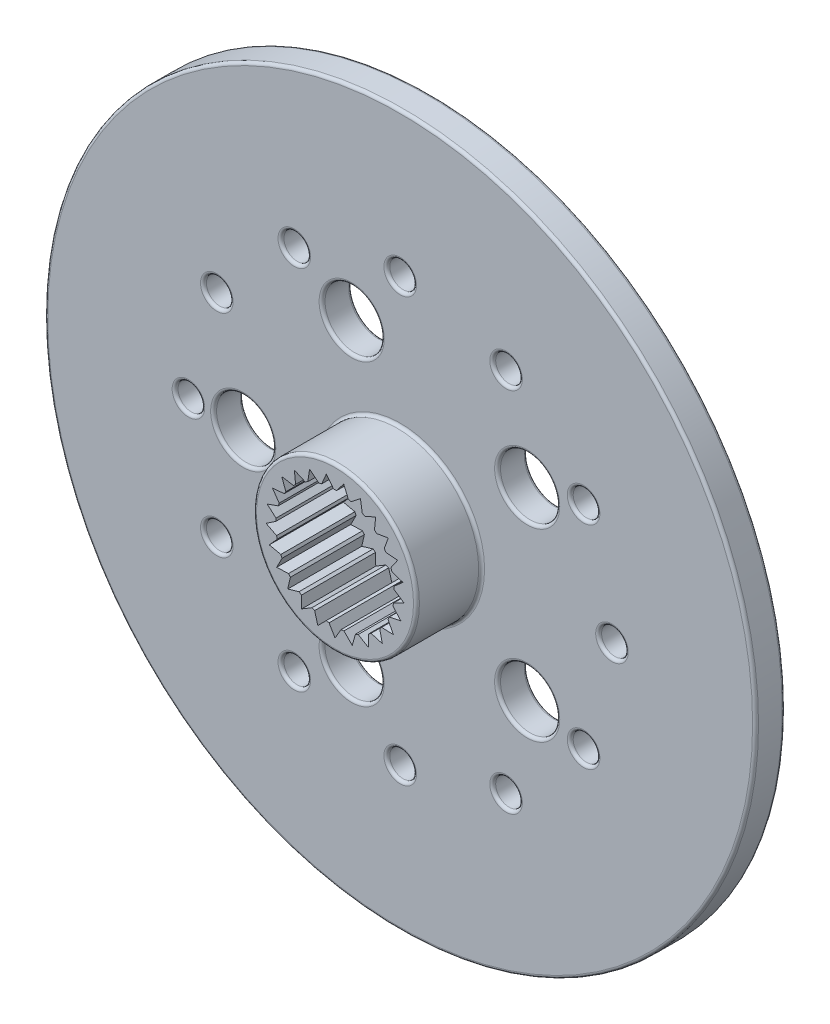
from build123d import *

# Parameters (mm, degrees)
ESQUISSE1_R                = 12
BOSS_EXTRU_1_DEPTH         = 1
ESQUISSE2_R                = 2.75
BOSS_EXTRU_2_DEPTH         = 2.2
ESQUISSE3_R                = 2
ENL_V_MAT_EXTRU_1_DEPTH    = 2.5
CUT_EXTRUDE1_DEPTH         = 2.5
CIRPATTERN1_COUNT          = 25
ESQUISSE4_R                = 1.6
ENL_V_MAT_EXTRU_2_DEPTH    = 0.4
ESQUISSE5_R                = 0.85
ENL_V_MAT_EXTRU_3_DEPTH    = 4.8
F_0_9_0_9_DIAMETER_HOLE1_D = 0.9
CIRPATTERN2_COUNT          = 12
F_2_0_2_DIAMETER_HOLE1_D   = 2
CIRPATTERN3_COUNT          = 5
FILLET1_R                  = 0.1


with BuildPart() as part:
    # Esquisse1 → Boss.-Extru.1 (new body)
    with BuildSketch(Plane.XY):
        Circle(ESQUISSE1_R)
    extrude(amount=BOSS_EXTRU_1_DEPTH)

    # Esquisse2 → Boss.-Extru.2 (add)
    with BuildSketch(Plane.XY.offset(1)):
        Circle(ESQUISSE2_R)
    extrude(amount=BOSS_EXTRU_2_DEPTH)

    # Esquisse3 → Enlèv. mat.-Extru.1 (cut)
    with BuildSketch(Plane.XY.offset(3.2)):
        Circle(ESQUISSE3_R)
    extrude(amount=-ENL_V_MAT_EXTRU_1_DEPTH, mode=Mode.SUBTRACT)

    # Sketch1 → Cut-Extrude1 (cut)
    with BuildSketch(Plane.XY.offset(3.2)):
        with BuildLine():
            Line((0.20072343, -1.989902034), (0, -2.334))
            Line((0, -2.334), (-0.20072343, -1.989902034))
            ThreePointArc((-0.20072343, -1.989902034), (0, -2), (0.20072343, -1.989902034))
        make_face()
    cut_extrude1 = extrude(amount=-CUT_EXTRUDE1_DEPTH, mode=Mode.SUBTRACT)

    # CirPattern1: Cut-Extrude1 ×25 about axis
    cirpattern1_axis = Axis((0, 0, 0), (0, 0, 1))
    for i in range(1, CIRPATTERN1_COUNT):
        add(cut_extrude1.rotate(cirpattern1_axis, i * 360 / CIRPATTERN1_COUNT), mode=Mode.SUBTRACT)

    # Esquisse4 → Enlèv. mat.-Extru.2 (cut)
    with BuildSketch(Plane(origin=(0, 0, 0), x_dir=(-1, 0, 0), z_dir=(0, 0, -1))):
        Circle(ESQUISSE4_R)
    extrude(amount=-ENL_V_MAT_EXTRU_2_DEPTH, mode=Mode.SUBTRACT)

    # Esquisse5 → Enlèv. mat.-Extru.3 (cut)
    with BuildSketch(Plane(origin=(0, 0, 0.4), x_dir=(-1, 0, 0), z_dir=(0, 0, -1))):
        Circle(ESQUISSE5_R)
    extrude(amount=-ENL_V_MAT_EXTRU_3_DEPTH, mode=Mode.SUBTRACT)

    # Ø0.9 (0.9) Diameter Hole1 (through all)
    with Locations(Plane(origin=(0, 0, 0), x_dir=(-1, 0, 0), z_dir=(0, 0, -1))):
        with Locations((7.15, 0)):
            f_0_9_0_9_diameter_hole1 = Hole(F_0_9_0_9_DIAMETER_HOLE1_D / 2)

    # CirPattern2: Ø0.9 (0.9) Diameter Hole1 ×12 about axis
    cirpattern2_axis = Axis((0, 0, 0), (0, 0, 1))
    for i in range(1, CIRPATTERN2_COUNT):
        add(f_0_9_0_9_diameter_hole1.rotate(cirpattern2_axis, i * 360 / CIRPATTERN2_COUNT), mode=Mode.SUBTRACT)

    # Ø2.0 (2) Diameter Hole1 (through all)
    with Locations(Plane(origin=(0, 0, 0), x_dir=(-1, 0, 0), z_dir=(0, 0, -1))):
        with Locations((5.3, 0)):
            f_2_0_2_diameter_hole1 = Hole(F_2_0_2_DIAMETER_HOLE1_D / 2)

    # CirPattern3: Ø2.0 (2) Diameter Hole1 ×5 about axis
    cirpattern3_axis = Axis((0, 0, 0), (0, 0, 1))
    for i in range(1, CIRPATTERN3_COUNT):
        add(f_2_0_2_diameter_hole1.rotate(cirpattern3_axis, i * 360 / CIRPATTERN3_COUNT), mode=Mode.SUBTRACT)

    # Fillet1
    fillet1_edges = [part.edges().sort_by_distance(p)[0] for p in [
        (-12, 0, 0),
        (1.6, 0, 0),
        (-7.6, 0, 1),
        (-7.6, 0, 0),
        (-6.581793069, 3.8, 1),
        (-6.581793069, 3.8, 0),
        (-3.8, 6.581793069, 1),
        (-3.8, 6.581793069, 0),
        (0, 7.6, 1),
        (0, 7.6, 0),
        (3.8, 6.581793069, 1),
        (3.8, 6.581793069, 0),
        (6.581793069, 3.8, 1),
        (6.581793069, 3.8, 0),
        (7.6, 0, 1),
        (7.6, 0, 0),
        (6.581793069, -3.8, 1),
        (6.581793069, -3.8, 0),
        (3.8, -6.581793069, 1),
        (3.8, -6.581793069, 0),
        (0, -7.6, 1),
        (0, -7.6, 0),
        (-3.8, -6.581793069, 1),
        (-3.8, -6.581793069, 0),
        (-6.581793069, -3.8, 1),
        (-6.581793069, -3.8, 0),
        (-6.3, 0, 1),
        (-6.3, 0, 0),
        (-1.946807065, 5.991656053, 1),
        (-1.946807065, 5.991656053, 0),
        (5.096807065, 3.703047089, 1),
        (5.096807065, 3.703047089, 0),
        (5.096807065, -3.703047089, 1),
        (5.096807065, -3.703047089, 0),
        (-1.946807065, -5.991656053, 1),
        (-1.946807065, -5.991656053, 0),
        (-12, 0, 1),
        (-2.75, 0, 1),
        (-2.75, 0, 3.2),
    ]]
    fillet(fillet1_edges, radius=FILLET1_R)


solid = part.part
